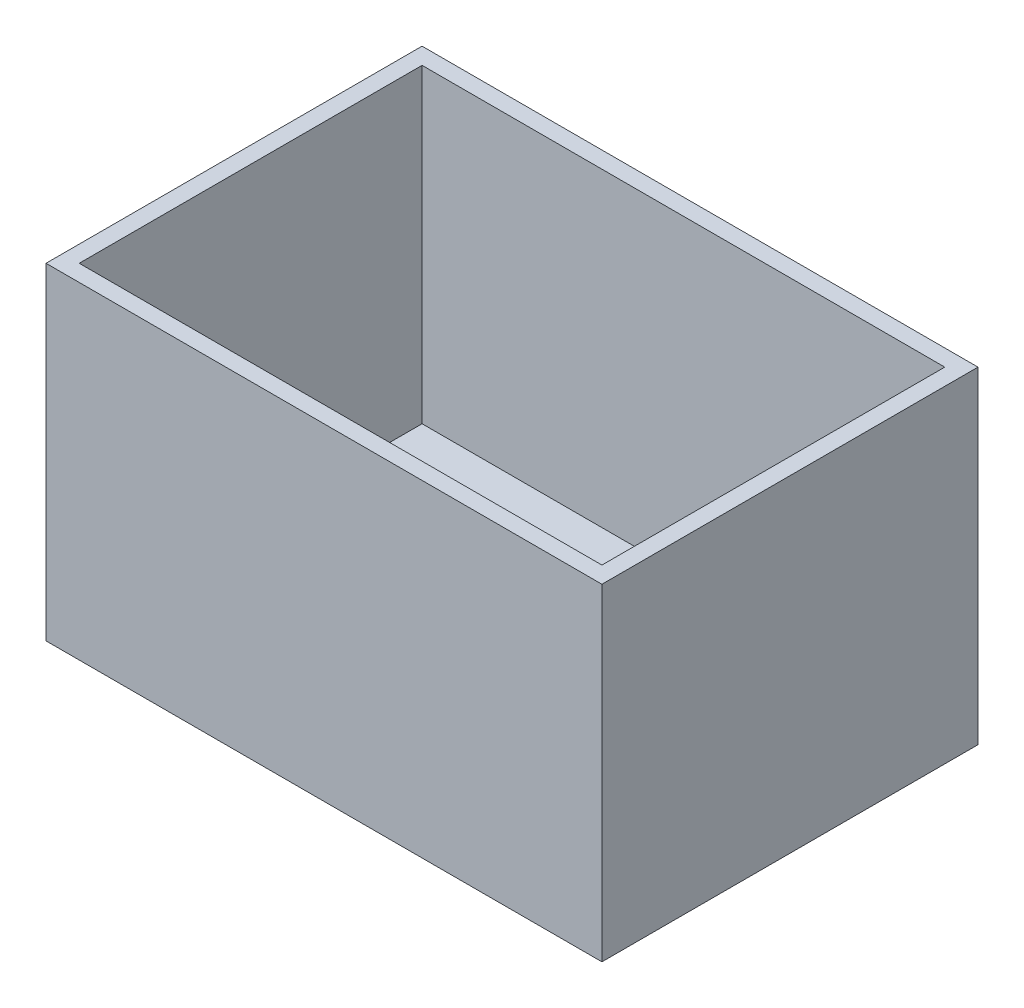
from build123d import *

# Parameters (mm, degrees)
SKETCH1_W           = 170
SKETCH1_H           = 115
BOSS_EXTRUDE1_DEPTH = 100
SHELL1_T            = -5.08


with BuildPart() as part:
    # Sketch1 → Boss-Extrude1 (new body)
    with BuildSketch(Plane(origin=(0, 0, 0), x_dir=(1, 0, 0), z_dir=(0, 1, 0))):
        Rectangle(SKETCH1_W, SKETCH1_H)
    extrude(amount=BOSS_EXTRUDE1_DEPTH)

    # Shell1
    shell1_openings = [part.faces().sort_by_distance(p)[0] for p in [
        (0, 100, 0),
    ]]
    offset(amount=SHELL1_T, openings=shell1_openings, kind=Kind.INTERSECTION)


solid = part.part
